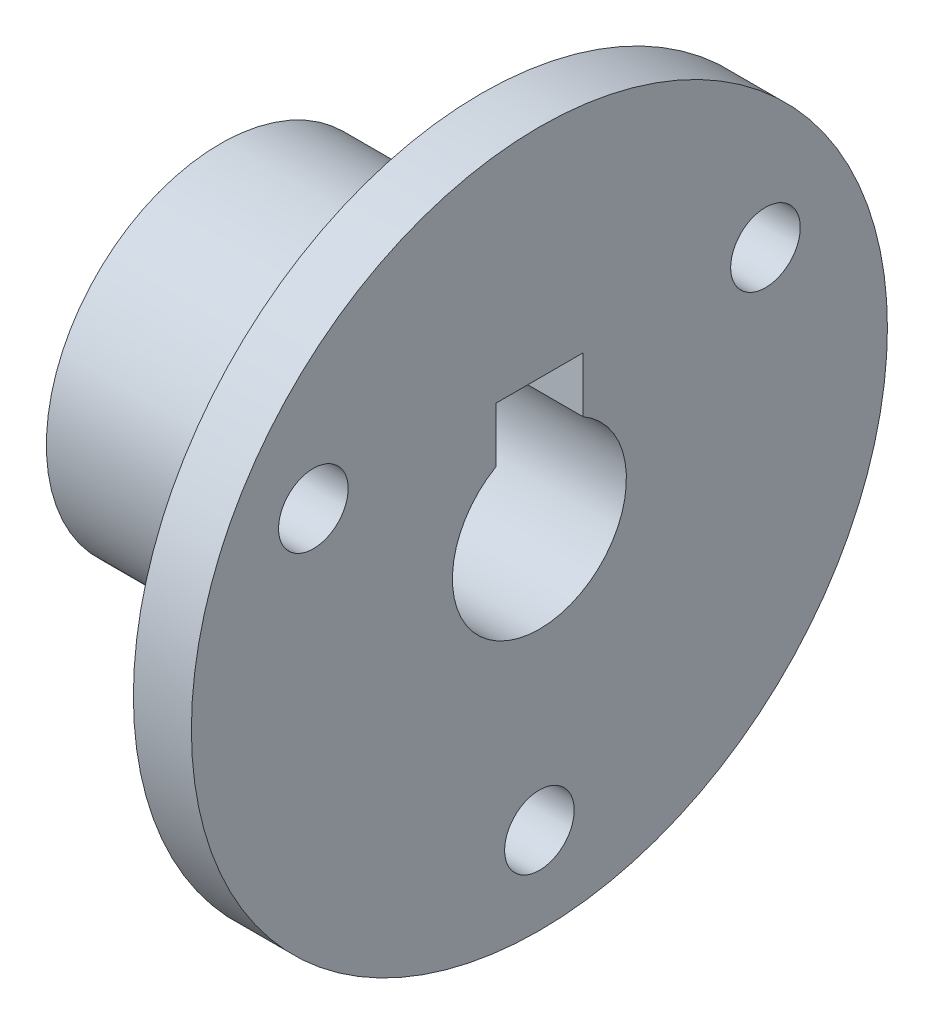
from build123d import *

# Parameters (mm, degrees)
SKETCH1_W                  = 10
SKETCH1_H                  = 60
SKETCH2_R                  = 30
BOSS_EXTRUDE1_DEPTH        = 45
CUT_EXTRUDE1_DEPTH         = 102.118742081
SKETCH4_W                  = 55
SKETCH4_H                  = 15
F_12_0_12_DIAMETER_HOLE1_D = 12


with BuildPart() as part:
    # Sketch1 → Revolve1 (revolve)
    with BuildSketch(Plane(origin=(0, 0, 0), x_dir=(-1, 0, 0), z_dir=(0, 0, -1)), mode=Mode.PRIVATE) as revolve1_sk:
        with Locations((-5, 30)):
            Rectangle(SKETCH1_W, SKETCH1_H)
    revolve(revolve1_sk.sketch.rotate(Axis((10, 0, 0), (-1, 0, 0)), 270), axis=Axis((10, 0, 0), (-1, 0, 0)))

    # Sketch2 → Boss-Extrude1 (add)
    with BuildSketch(Plane.ZY):
        with Locations(Location((0, 0, 0), (0, 0, 180))):
            Circle(SKETCH2_R)
    extrude(amount=BOSS_EXTRUDE1_DEPTH)

    # Sketch3 → Cut-Extrude1 (cut, through all)
    with BuildSketch(Plane.ZY.offset(45)):
        with BuildLine():
            Line((-7.5, 22.495647676), (-7.5, 12.990381057))
            ThreePointArc((-7.5, 12.990381057), (0, 15), (7.5, 12.990381057))
            Line((7.5, 12.990381057), (7.5, 22.495647676))
            Line((7.5, 22.495647676), (-7.5, 22.495647676))
        make_face()
    extrude(amount=-CUT_EXTRUDE1_DEPTH, mode=Mode.SUBTRACT)

    # Sketch4 → Cut-Revolve1 (revolve, cut)
    with BuildSketch(Plane(origin=(0, 0, 0), x_dir=(-1, 0, 0), z_dir=(0, 0, -1))):
        with Locations((17.5, 7.5)):
            Rectangle(SKETCH4_W, SKETCH4_H)
    revolve(axis=Axis((10, 0, 0), (-1, 0, 0)), mode=Mode.SUBTRACT)

    # Ø12.0 (12) Diameter Hole1 (through all)
    with Locations(Plane.ZY):
        with Locations((-38.97114317, 22.5), (38.97114317, 22.5), (0, -45)):
            Hole(F_12_0_12_DIAMETER_HOLE1_D / 2)


solid = part.part
